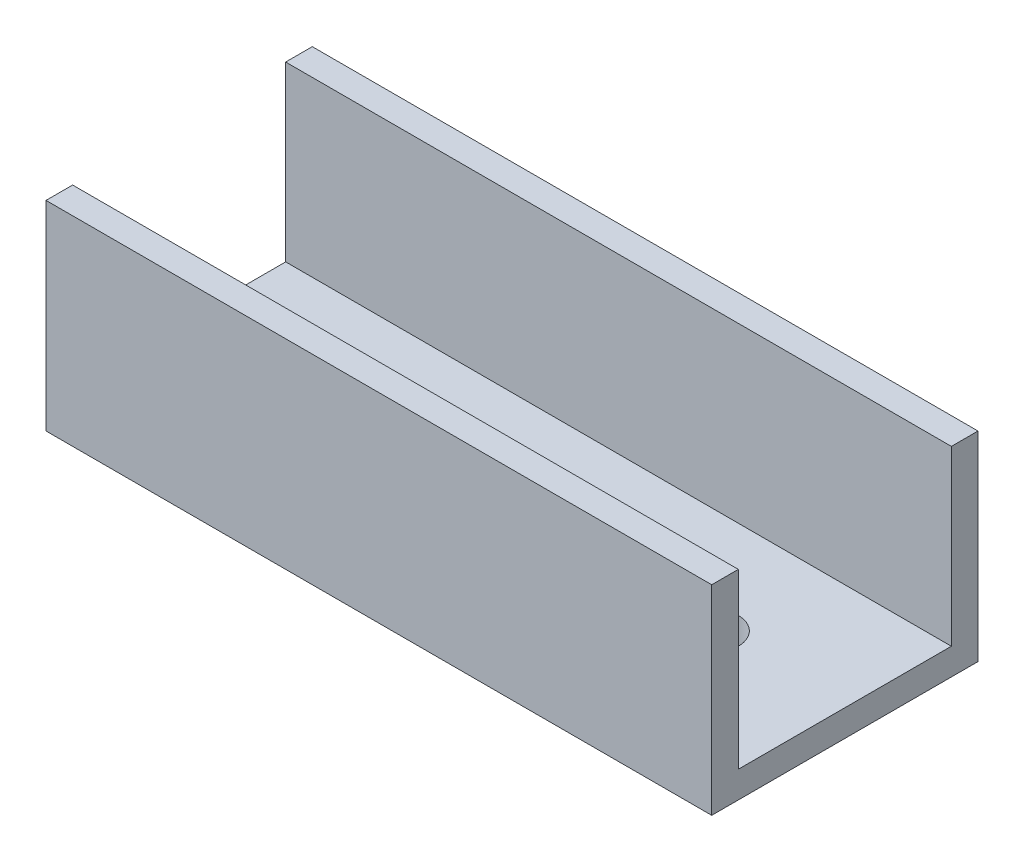
from build123d import *

# Parameters (mm, degrees)
EXTRUDE_1_DEPTH     = 100
SKETCH_2_R          = 4
CUT_EXTRUDE_1_DEPTH = 62.64414003


with BuildPart() as part:
    # 草图1 → 凸台-拉伸1 (new body)
    with BuildSketch(Plane(origin=(-50, 0, 0), x_dir=(0, 0, -1), z_dir=(1, 0, 0))):
        Polygon((20, 0), (-20, 0), (-20, 30), (-16, 30), (-16, 4), (16, 4), (16, 30), (20, 30), align=None)
    extrude(amount=EXTRUDE_1_DEPTH)

    # 草图2 → 切除-拉伸1 (cut, through all)
    with BuildSketch(Plane(origin=(0, 0, 0), x_dir=(1, 0, 0), z_dir=(0, 1, 0))):
        with Locations(Location((-30, 0, 0), (0, 0, 90))):
            Circle(SKETCH_2_R)
        with Locations(Location((0, 0, 0), (0, 0, 90))):
            Circle(SKETCH_2_R)
        with Locations(Location((30, 0, 0), (0, 0, 90))):
            Circle(SKETCH_2_R)
    extrude(amount=CUT_EXTRUDE_1_DEPTH, mode=Mode.SUBTRACT)


solid = part.part
